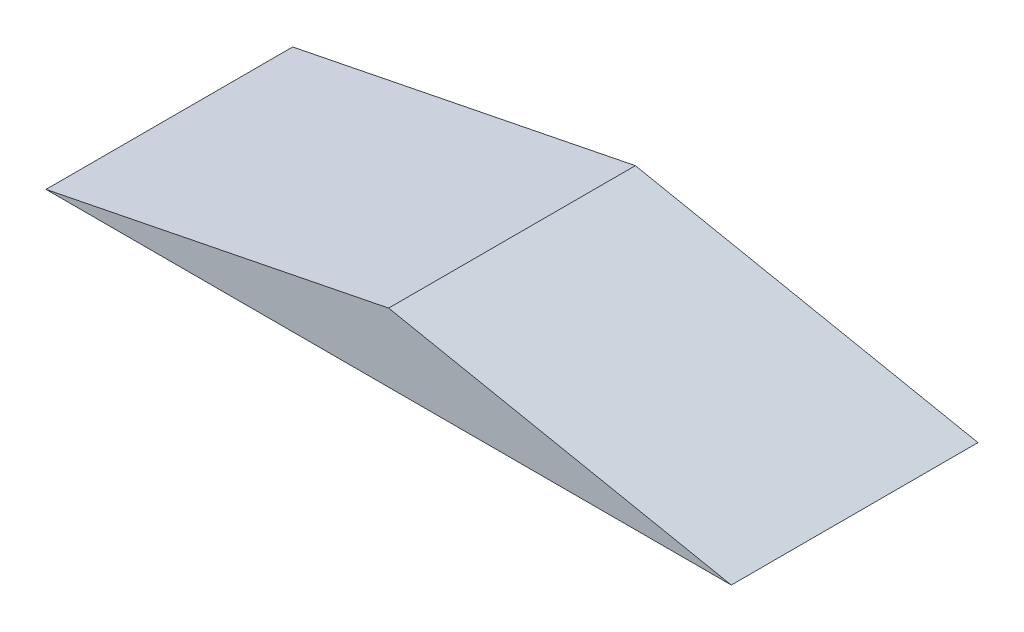
from build123d import *

# Parameters (mm, degrees)
BOSS_EXTRUDE1_DEPTH = 1800


with BuildPart() as part:
    # Sketch1 → Boss-Extrude1 (new body)
    with BuildSketch(Plane.XY):
        Polygon((0, 0), (5000, 0), (2500, 500), align=None)
    extrude(amount=BOSS_EXTRUDE1_DEPTH)


solid = part.part
